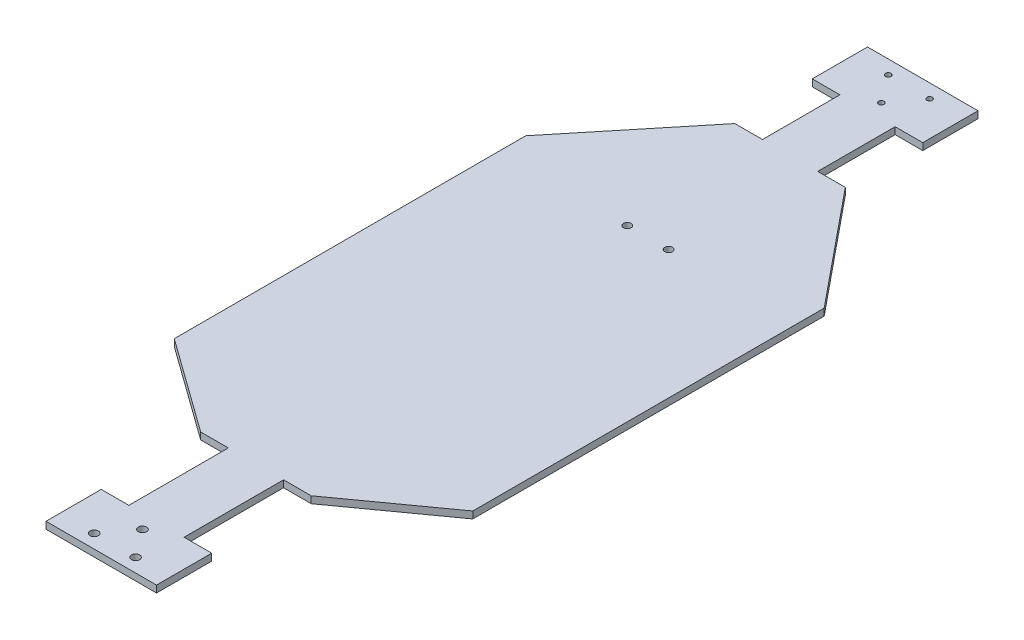
from build123d import *

# Parameters (mm, degrees)
SKETCH2_R           = 1.256430983
SKETCH2_R_2         = 1.905
SKETCH2_R_3         = 1.776231012
BOSS_EXTRUDE2_DEPTH = 3.175


with BuildPart() as part:
    # Sketch2 → Boss-Extrude2 (new body)
    with BuildSketch(Plane(origin=(0, 0, 0), x_dir=(1, 0, 0), z_dir=(0, 1, 0))):
        Polygon((25.4, -151.533371864), (-25.4, -151.533371864), (-25.4, -126.133371864), (-12.7, -126.133371864), (-12.7, -80.413371864), (-25.4, -80.413371864), (-68.619910987, -49.323669691), (-68.619910987, 0), (-68.619910987, 112.251832626), (-25.4, 165.193433608), (-12.7, 165.193433608), (-12.7, 200.795669484), (-25.4, 200.795669484), (-25.4, 226.195669484), (25.4, 226.195669484), (25.4, 200.795669484), (12.7, 200.795669484), (12.7, 165.193433608), (25.4, 165.193433608), (68.619910987, 112.251832626), (68.619910987, 0), (68.619910987, -49.323669691), (25.4, -80.413371864), (12.7, -80.413371864), (12.7, -126.133371864), (25.4, -126.133371864), align=None)
        with Locations(Location((-9.525, 219.845669484, 0), (0, 0, 270))):
            Circle(SKETCH2_R, mode=Mode.SUBTRACT)
        with Locations(Location((9.525, 219.845669484, 0), (0, 0, 270))):
            Circle(SKETCH2_R, mode=Mode.SUBTRACT)
        with Locations(Location((0, 207.145669484, 0), (0, 0, 270))):
            Circle(SKETCH2_R, mode=Mode.SUBTRACT)
        with Locations(Location((9.525, -145.279330516, 0), (0, 0, 270))):
            Circle(SKETCH2_R_2, mode=Mode.SUBTRACT)
        with Locations(Location((0, -132.579330516, 0), (0, 0, 270))):
            Circle(SKETCH2_R_2, mode=Mode.SUBTRACT)
        with Locations(Location((-9.525, -145.279330516, 0), (0, 0, 270))):
            Circle(SKETCH2_R_2, mode=Mode.SUBTRACT)
        with Locations(Location((-9.525, 99.829892631, 0), (0, 0, 270))):
            Circle(SKETCH2_R_3, mode=Mode.SUBTRACT)
        with Locations(Location((9.525, 99.829892631, 0), (0, 0, 270))):
            Circle(SKETCH2_R_3, mode=Mode.SUBTRACT)
    extrude(amount=BOSS_EXTRUDE2_DEPTH)


solid = part.part
